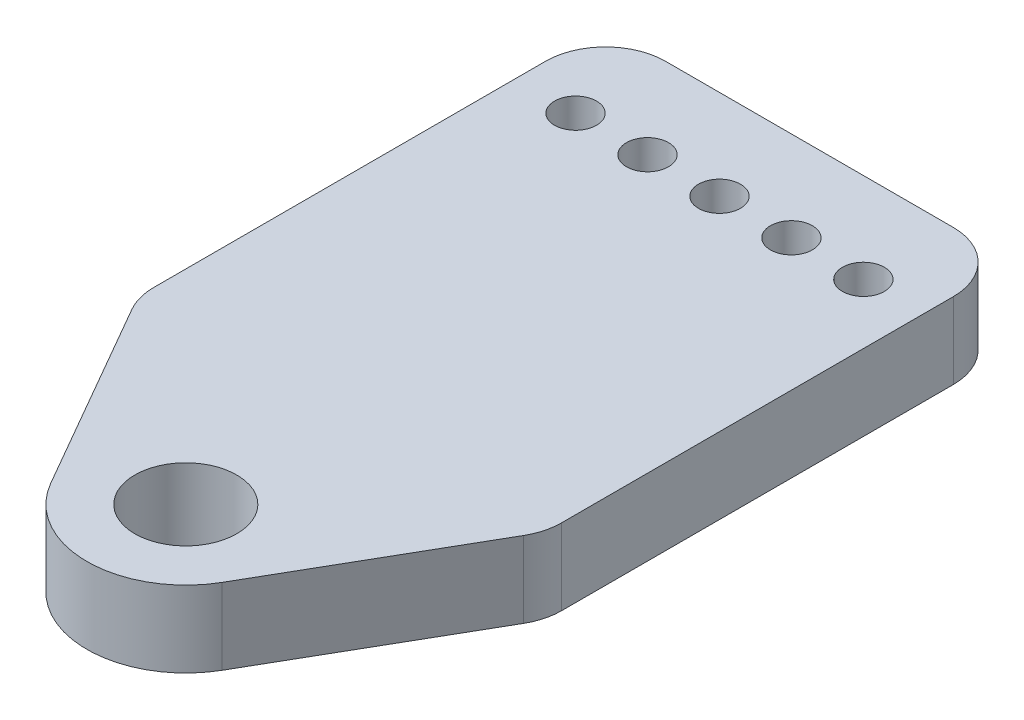
from build123d import *

# Parameters (mm, degrees)
SKETCH1_R           = 1.75
SKETCH1_R_2         = 4.25
BOSS_EXTRUDE1_DEPTH = 6.35
FILLET1_R           = 5


with BuildPart() as part:
    # Sketch1 → Boss-Extrude1 (new body)
    with BuildSketch(Plane(origin=(0, 0, 0), x_dir=(1, 0, 0), z_dir=(0, 1, 0))):
        with BuildLine():
            Line((-5, 7.5), (29, 7.5))
            Line((29, 7.5), (29, -31.5))
            Line((29, -31.5), (19.150459769, -48.615024313))
            ThreePointArc((19.150459769, -48.615024313), (12, -52.75), (4.849540231, -48.615024313))
            Line((4.849540231, -48.615024313), (-5, -31.5))
            Line((-5, -31.5), (-5, 7.5))
        make_face()
        with Locations(Location((0, 0, 0), (0, 0, 270))):
            Circle(SKETCH1_R, mode=Mode.SUBTRACT)
        with Locations(Location((6, 0, 0), (0, 0, 270))):
            Circle(SKETCH1_R, mode=Mode.SUBTRACT)
        with Locations(Location((12, 0, 0), (0, 0, 270))):
            Circle(SKETCH1_R, mode=Mode.SUBTRACT)
        with Locations(Location((18, 0, 0), (0, 0, 270))):
            Circle(SKETCH1_R, mode=Mode.SUBTRACT)
        with Locations(Location((24, 0, 0), (0, 0, 270))):
            Circle(SKETCH1_R, mode=Mode.SUBTRACT)
        with Locations(Location((12, -44.5, 0), (0, 0, 270))):
            Circle(SKETCH1_R_2, mode=Mode.SUBTRACT)
    extrude(amount=BOSS_EXTRUDE1_DEPTH)

    # Fillet1
    fillet1_edges = [part.edges().sort_by_distance(p)[0] for p in [
        (29, 3.175, 31.5),
        (-5, 3.175, 31.5),
        (-5, 3.175, -7.5),
        (29, 3.175, -7.5),
    ]]
    fillet(fillet1_edges, radius=FILLET1_R)


solid = part.part
